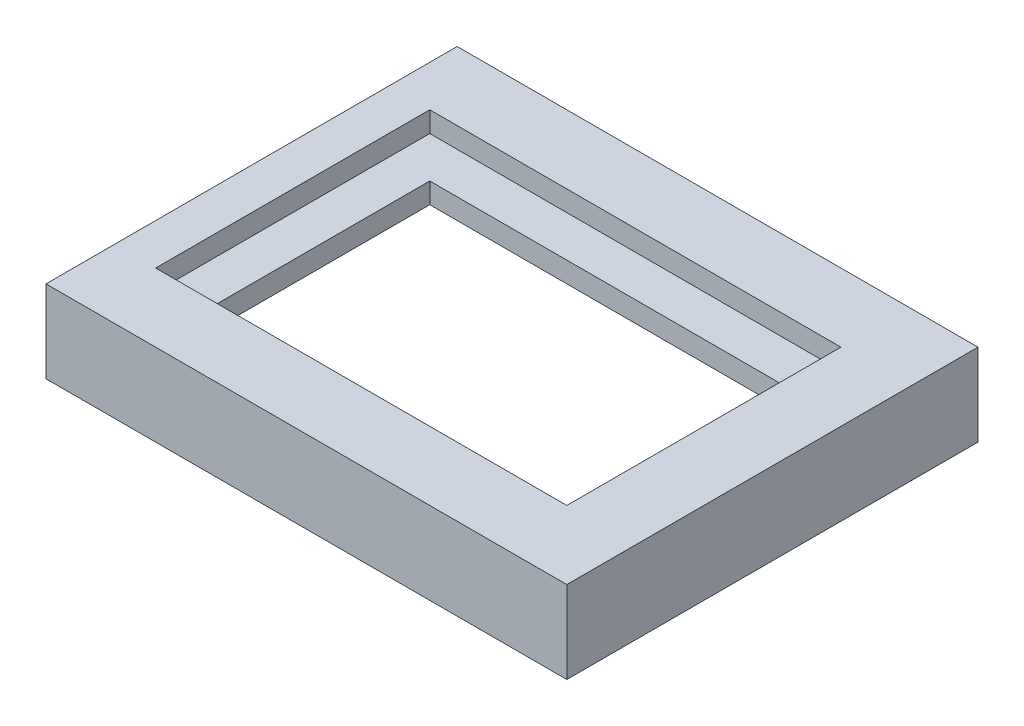
from build123d import *

# Parameters (mm, degrees)
SKETCH1_W           = 20
SKETCH1_H           = 15
BOSS_EXTRUDE3_DEPTH = 3
SKETCH4_W           = 13
SKETCH4_H           = 1.5
CUT_EXTRUDE1_DEPTH  = 18
SKETCH5_W           = 15
SKETCH5_H           = 10
CUT_EXTRUDE2_DEPTH  = 18
SKETCH5_3_W         = 1
SKETCH5_3_H         = 15
CUT_EXTRUDE3_DEPTH  = 18


with BuildPart() as part:
    # Sketch1 → Boss-Extrude3 (new body)
    with BuildSketch(Plane(origin=(0, 0, 0), x_dir=(1, 0, 0), z_dir=(0, 1, 0))):
        Rectangle(SKETCH1_W, SKETCH1_H)
    extrude(amount=BOSS_EXTRUDE3_DEPTH)

    # Sketch4 → Cut-Extrude1 (cut)
    with BuildSketch(Plane.ZY.offset(10)):
        with Locations((0, 1.5)):
            Rectangle(SKETCH4_W, SKETCH4_H)
    extrude(amount=-CUT_EXTRUDE1_DEPTH, mode=Mode.SUBTRACT)

    # Sketch5 → Cut-Extrude2 (cut)
    with BuildSketch(Plane(origin=(0, 3, 0), x_dir=(1, 0, 0), z_dir=(0, 1, 0))):
        with Locations((-1, 0)):
            Rectangle(SKETCH5_W, SKETCH5_H)
    extrude(amount=-CUT_EXTRUDE2_DEPTH, mode=Mode.SUBTRACT)

    # Sketch5<3> → Cut-Extrude3 (cut)
    with BuildSketch(Plane(origin=(0, 3, 0), x_dir=(1, 0, 0), z_dir=(0, 1, 0))):
        with Locations((9.5, 0)):
            Rectangle(SKETCH5_3_W, SKETCH5_3_H)
    extrude(amount=-CUT_EXTRUDE3_DEPTH, mode=Mode.SUBTRACT)


solid = part.part
